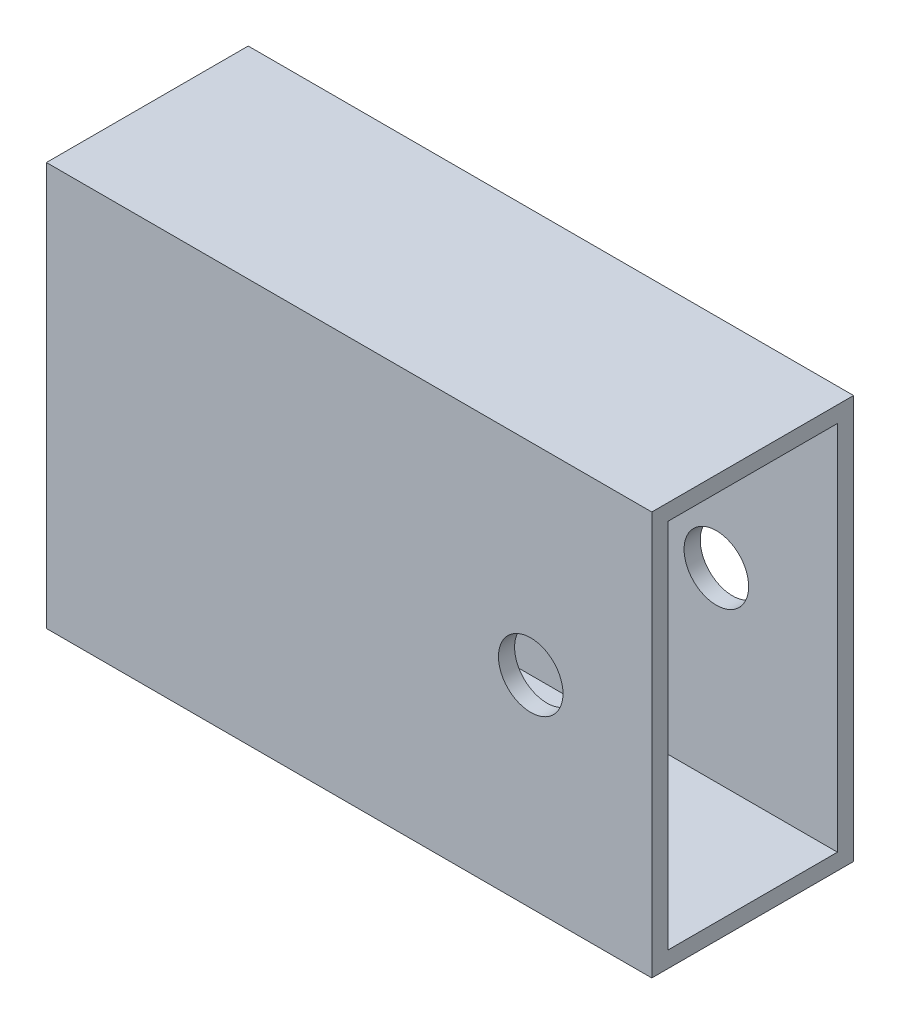
from build123d import *

# Parameters (mm, degrees)
SKETCH1_W           = 25
SKETCH1_H           = 50
SKETCH1_W_2         = 21
SKETCH1_H_2         = 46
BOSS_EXTRUDE1_DEPTH = 75
SKETCH2_R           = 4
CUT_EXTRUDE1_DEPTH  = 94.541434669


with BuildPart() as part:
    # Sketch1 → Boss-Extrude1 (new body)
    with BuildSketch(Plane(origin=(0, 0, 0), x_dir=(0, 0, -1), z_dir=(1, 0, 0))):
        with Locations((12.5, 25)):
            Rectangle(SKETCH1_W, SKETCH1_H)
        with Locations((12.5, 25)):
            Rectangle(SKETCH1_W_2, SKETCH1_H_2, mode=Mode.SUBTRACT)
    extrude(amount=BOSS_EXTRUDE1_DEPTH)

    # Sketch2 → Cut-Extrude1 (cut, through all)
    with BuildSketch(Plane.XY):
        with Locations((60, 25)):
            Circle(SKETCH2_R)
    extrude(amount=-CUT_EXTRUDE1_DEPTH, mode=Mode.SUBTRACT)


solid = part.part
